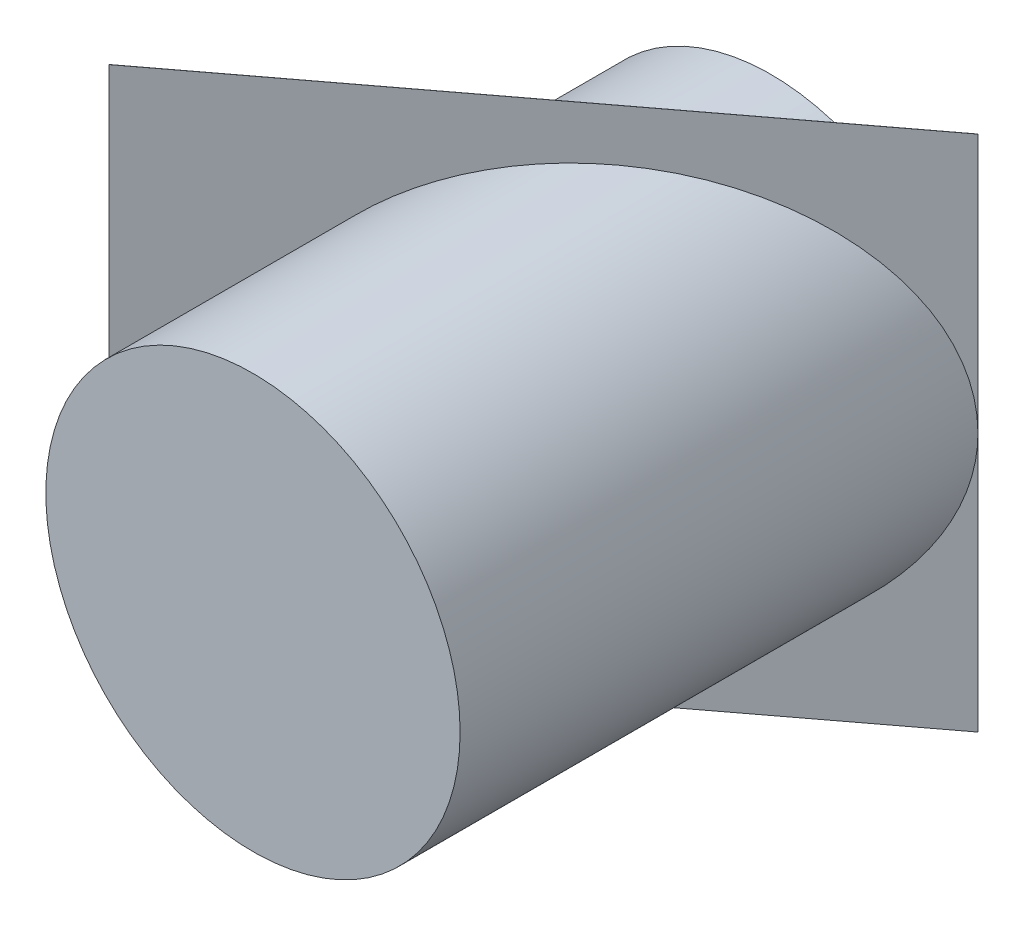
from build123d import *

# Parameters (mm, degrees)
SKETCH_1_R        = 20
EXTRUDE_1_DEPTH   = 50
EXTRUDE_1_2_DEPTH = 25


with BuildPart() as part:
    # 草图1 → Extrude 1 (new body)
    with BuildSketch(Plane.XY):
        Circle(SKETCH_1_R)
    extrude(amount=EXTRUDE_1_DEPTH)

    # 草图3 → Extrude 1 2 (add, symmetric)
    with BuildSketch(Plane(origin=(0, 0, 0), x_dir=(1, 0, 0), z_dir=(0, 1, 0))):
        Polygon((20, 0), (-27.7557358, -36.128356044), (-27.761769046, -36.120381086), (19.993966754, 0.007974957), align=None)
    extrude(amount=EXTRUDE_1_2_DEPTH, both=True)


solid = part.part
